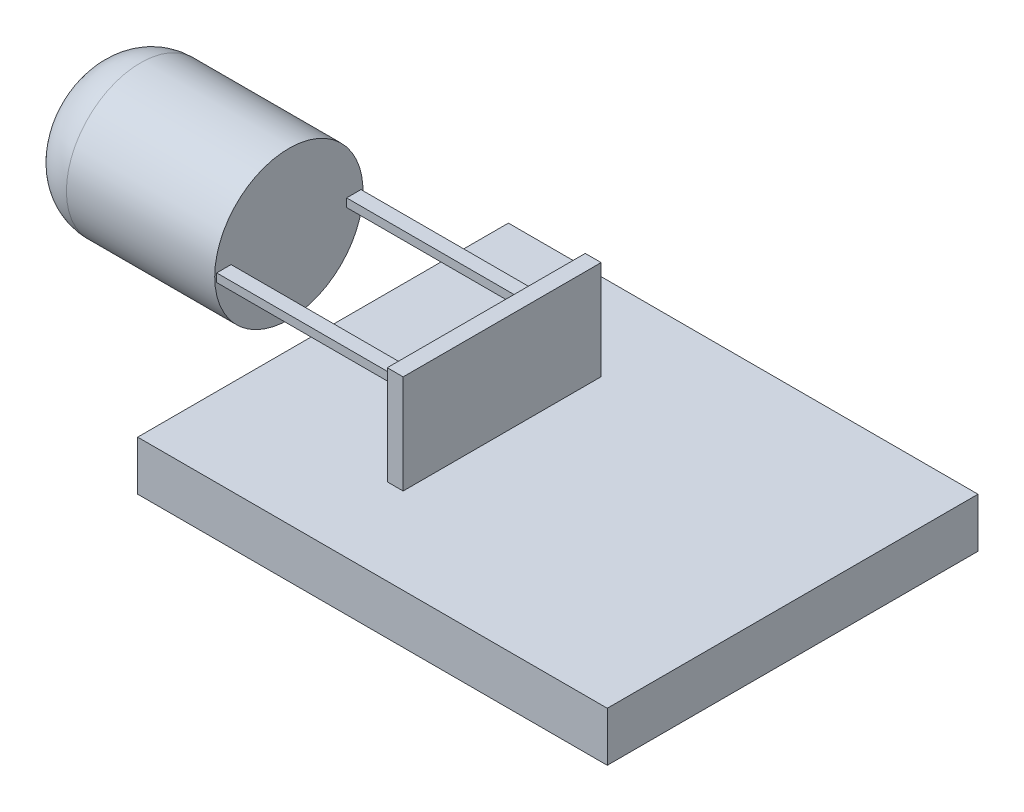
from build123d import *

# Parameters (mm, degrees)
ESQUISSE1_W        = 19
ESQUISSE1_H        = 15
BOSS_EXTRU_1_DEPTH = 2
ESQUISSE2_W        = 0.642500129
ESQUISSE2_H        = 8.011173479
BOSS_EXTRU_2_DEPTH = 4
ESQUISSE3_W        = 0.58049635
ESQUISSE3_H        = 0.338622871
BOSS_EXTRU_3_DEPTH = 8
ESQUISSE4_R        = 3
BOSS_EXTRU_4_DEPTH = 8
CONG_1_R           = 2


with BuildPart() as part:
    # Esquisse1 → Boss.-Extru.1 (new body)
    with BuildSketch(Plane(origin=(0, 0, 0), x_dir=(1, 0, 0), z_dir=(0, 1, 0))):
        Rectangle(ESQUISSE1_W, ESQUISSE1_H)
    extrude(amount=BOSS_EXTRU_1_DEPTH)

    # Esquisse2 → Boss.-Extru.2 (add)
    with BuildSketch(Plane(origin=(0, 2, 0), x_dir=(1, 0, 0), z_dir=(0, 1, 0))):
        with Locations((-2.562175711, -0.012775057)):
            Rectangle(ESQUISSE2_W, ESQUISSE2_H)
    extrude(amount=BOSS_EXTRU_2_DEPTH)

    # Esquisse3 → Boss.-Extru.3 (add)
    with BuildSketch(Plane.ZY.offset(2.883425775)):
        with Locations((-2.628358474, 4.603596233)):
            Rectangle(ESQUISSE3_W, ESQUISSE3_H)
    boss_extru_3 = extrude(amount=BOSS_EXTRU_3_DEPTH)

    # Symétrie1: Boss.-Extru.3 across plane
    add(boss_extru_3.mirror(Plane.XY))

    # Esquisse4 → Boss.-Extru.4 (add)
    with BuildSketch(Plane.ZY.offset(10.883425775)):
        with Locations((0, 4.67632737)):
            Circle(ESQUISSE4_R)
    extrude(amount=BOSS_EXTRU_4_DEPTH)

    # Congé1
    cong_1_edges = [part.edges().sort_by_distance(p)[0] for p in [
        (-18.883425775, 4.67632737, -3),
    ]]
    fillet(cong_1_edges, radius=CONG_1_R)


solid = part.part
